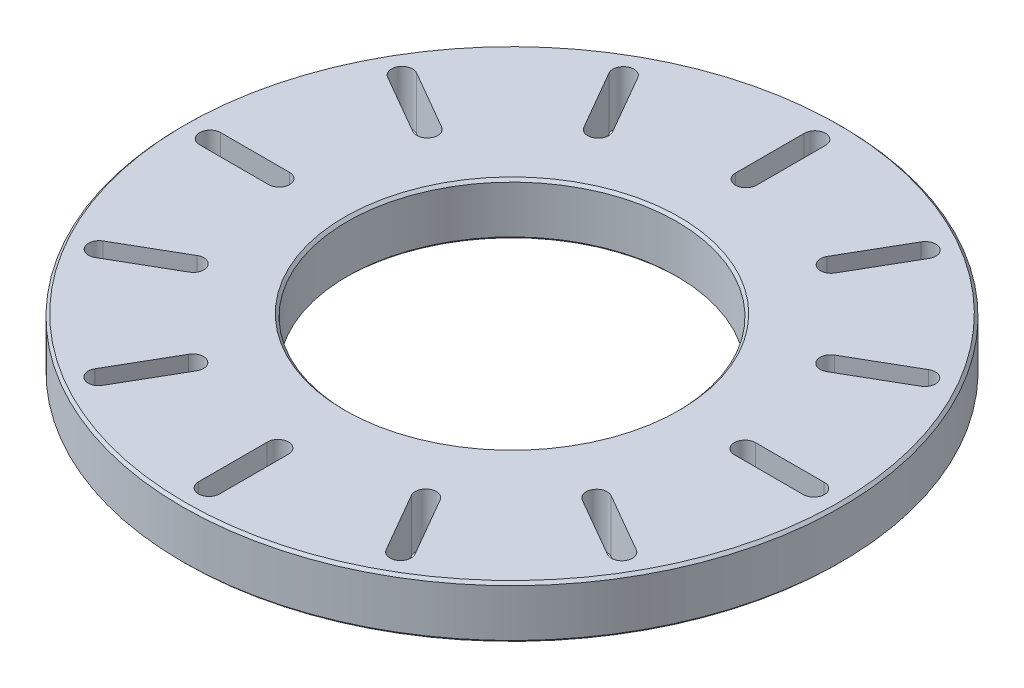
from build123d import *

# Parameters (mm, degrees)
SKETCH1_R           = 25
SKETCH1_R_2         = 12.5
BOSS_EXTRUDE1_DEPTH = 4
CHAMFER1_SIZE       = 0.2


with BuildPart() as part:
    # Sketch1 → Boss-Extrude1 (new body)
    with BuildSketch(Plane(origin=(0, 0, 0), x_dir=(1, 0, 0), z_dir=(0, 1, 0))):
        with Locations(Location((0, 0, 0), (0, 0, 270))):
            Circle(SKETCH1_R)
        with BuildLine():
            ThreePointArc((0.758245274, -22.952787235), (-0.048003188, -23.74036389), (-0.841852323, -22.940290693))
            Line((-0.841852323, -22.940290693), (-0.841508405, -17.728184123))
            ThreePointArc((-0.841508405, -17.728184123), (-0.841754725, -17.708280546), (-0.841505778, -17.688377001))
            ThreePointArc((-0.841505778, -17.688377001), (-0.031775784, -16.908395573), (0.758245274, -17.708333333))
            Line((0.758245274, -17.708333333), (0.758245274, -22.927794152))
            Line((0.758245274, -22.927794152), (0.758245274, -22.952787235))
        make_face(mode=Mode.SUBTRACT)
        with BuildLine():
            ThreePointArc((-10.819733948, -20.25681947), (-11.911753925, -20.53575663), (-12.199210844, -19.445948349))
            Line((-12.199210844, -19.445948349), (-9.592859718, -14.932303611))
            ThreePointArc((-9.592859718, -14.932303611), (-9.583121248, -14.914943448), (-9.572953882, -14.897830945))
            ThreePointArc((-9.572953882, -14.897830945), (-8.481716422, -14.627212211), (-8.197506997, -15.714989162))
            Line((-8.197506997, -15.714989162), (-10.807237407, -20.235174825))
            Line((-10.807237407, -20.235174825), (-10.819733948, -20.25681947))
        make_face(mode=Mode.SUBTRACT)
        with BuildLine():
            ThreePointArc((-19.498574197, -12.133053287), (-20.583759818, -11.828609965), (-20.287800672, -10.741079849))
            Line((-20.287800672, -10.741079849), (-15.773812016, -8.135324406))
            ThreePointArc((-15.773812016, -8.135324406), (-15.756698172, -8.125159298), (-15.739336724, -8.115423119))
            ThreePointArc((-15.739336724, -8.115423119), (-14.658987995, -8.42667915), (-14.956743889, -9.510826336))
            Line((-14.956743889, -9.510826336), (-19.476929551, -12.120556745))
            Line((-19.476929551, -12.120556745), (-19.498574197, -12.133053287))
        make_face(mode=Mode.SUBTRACT)
        with BuildLine():
            ThreePointArc((12.133053287, -19.498574197), (11.828609965, -20.583759818), (10.741079849, -20.287800672))
            Line((10.741079849, -20.287800672), (8.135324406, -15.773812016))
            ThreePointArc((8.135324406, -15.773812016), (8.125159298, -15.756698172), (8.115423119, -15.739336724))
            ThreePointArc((8.115423119, -15.739336724), (8.42667915, -14.658987995), (9.510826336, -14.956743889))
            Line((9.510826336, -14.956743889), (12.120556745, -19.476929551))
            Line((12.120556745, -19.476929551), (12.133053287, -19.498574197))
        make_face(mode=Mode.SUBTRACT)
        with BuildLine():
            ThreePointArc((20.25681947, -10.819733948), (20.53575663, -11.911753925), (19.445948349, -12.199210844))
            Line((19.445948349, -12.199210844), (14.932303611, -9.592859718))
            ThreePointArc((14.932303611, -9.592859718), (14.914943448, -9.583121248), (14.897830945, -9.572953882))
            ThreePointArc((14.897830945, -9.572953882), (14.627212211, -8.481716422), (15.714989162, -8.197506997))
            Line((15.714989162, -8.197506997), (20.235174825, -10.807237407))
            Line((20.235174825, -10.807237407), (20.25681947, -10.819733948))
        make_face(mode=Mode.SUBTRACT)
        with BuildLine():
            ThreePointArc((22.952787235, 0.758245274), (23.74036389, -0.048003188), (22.940290693, -0.841852323))
            Line((22.940290693, -0.841852323), (17.728184123, -0.841508405))
            ThreePointArc((17.728184123, -0.841508405), (17.708280546, -0.841754725), (17.688377001, -0.841505778))
            ThreePointArc((17.688377001, -0.841505778), (16.908395573, -0.031775784), (17.708333333, 0.758245274))
            Line((17.708333333, 0.758245274), (22.927794152, 0.758245274))
            Line((22.927794152, 0.758245274), (22.952787235, 0.758245274))
        make_face(mode=Mode.SUBTRACT)
        with BuildLine():
            ThreePointArc((-22.952787235, -0.758245274), (-23.74036389, 0.048003188), (-22.940290693, 0.841852323))
            Line((-22.940290693, 0.841852323), (-17.728184123, 0.841508405))
            ThreePointArc((-17.728184123, 0.841508405), (-17.708280546, 0.841754725), (-17.688377001, 0.841505778))
            ThreePointArc((-17.688377001, 0.841505778), (-16.908395573, 0.031775784), (-17.708333333, -0.758245274))
            Line((-17.708333333, -0.758245274), (-22.927794152, -0.758245274))
            Line((-22.927794152, -0.758245274), (-22.952787235, -0.758245274))
        make_face(mode=Mode.SUBTRACT)
        with BuildLine():
            ThreePointArc((-20.25681947, 10.819733948), (-20.53575663, 11.911753925), (-19.445948349, 12.199210844))
            Line((-19.445948349, 12.199210844), (-14.932303611, 9.592859718))
            ThreePointArc((-14.932303611, 9.592859718), (-14.914943448, 9.583121248), (-14.897830945, 9.572953882))
            ThreePointArc((-14.897830945, 9.572953882), (-14.627212211, 8.481716422), (-15.714989162, 8.197506997))
            Line((-15.714989162, 8.197506997), (-20.235174825, 10.807237407))
            Line((-20.235174825, 10.807237407), (-20.25681947, 10.819733948))
        make_face(mode=Mode.SUBTRACT)
        with Locations(Location((0, 0, 0), (0, 0, 270))):
            Circle(SKETCH1_R_2, mode=Mode.SUBTRACT)
        with BuildLine():
            ThreePointArc((-12.133053287, 19.498574197), (-11.828609965, 20.583759818), (-10.741079849, 20.287800672))
            Line((-10.741079849, 20.287800672), (-8.135324406, 15.773812016))
            ThreePointArc((-8.135324406, 15.773812016), (-8.125159298, 15.756698172), (-8.115423119, 15.739336724))
            ThreePointArc((-8.115423119, 15.739336724), (-8.42667915, 14.658987995), (-9.510826336, 14.956743889))
            Line((-9.510826336, 14.956743889), (-12.120556745, 19.476929551))
            Line((-12.120556745, 19.476929551), (-12.133053287, 19.498574197))
        make_face(mode=Mode.SUBTRACT)
        with BuildLine():
            ThreePointArc((19.498574197, 12.133053287), (20.583759818, 11.828609965), (20.287800672, 10.741079849))
            Line((20.287800672, 10.741079849), (15.773812016, 8.135324406))
            ThreePointArc((15.773812016, 8.135324406), (15.756698172, 8.125159298), (15.739336724, 8.115423119))
            ThreePointArc((15.739336724, 8.115423119), (14.658987995, 8.42667915), (14.956743889, 9.510826336))
            Line((14.956743889, 9.510826336), (19.476929551, 12.120556745))
            Line((19.476929551, 12.120556745), (19.498574197, 12.133053287))
        make_face(mode=Mode.SUBTRACT)
        with BuildLine():
            ThreePointArc((10.819733948, 20.25681947), (11.911753925, 20.53575663), (12.199210844, 19.445948349))
            Line((12.199210844, 19.445948349), (9.592859718, 14.932303611))
            ThreePointArc((9.592859718, 14.932303611), (9.583121248, 14.914943448), (9.572953882, 14.897830945))
            ThreePointArc((9.572953882, 14.897830945), (8.481716422, 14.627212211), (8.197506997, 15.714989162))
            Line((8.197506997, 15.714989162), (10.807237407, 20.235174825))
            Line((10.807237407, 20.235174825), (10.819733948, 20.25681947))
        make_face(mode=Mode.SUBTRACT)
        with BuildLine():
            ThreePointArc((0.841505778, 17.688377001), (0.031775784, 16.908395573), (-0.758245274, 17.708333333))
            Line((-0.758245274, 17.708333333), (-0.758245274, 22.927794152))
            Line((-0.758245274, 22.927794152), (-0.758245274, 22.952787235))
            ThreePointArc((-0.758245274, 22.952787235), (0.048003188, 23.74036389), (0.841852323, 22.940290693))
            Line((0.841852323, 22.940290693), (0.841508405, 17.728184123))
            ThreePointArc((0.841508405, 17.728184123), (0.841754725, 17.708280546), (0.841505778, 17.688377001))
        make_face(mode=Mode.SUBTRACT)
    extrude(amount=BOSS_EXTRUDE1_DEPTH)

    # Chamfer1
    chamfer1_edges = [part.edges().sort_by_distance(p)[0] for p in [
        (0, 4, -12.5),
        (0, 4, -25),
        (0, 0, -25),
        (0, 0, -12.5),
    ]]
    chamfer(chamfer1_edges, length=CHAMFER1_SIZE)


solid = part.part
